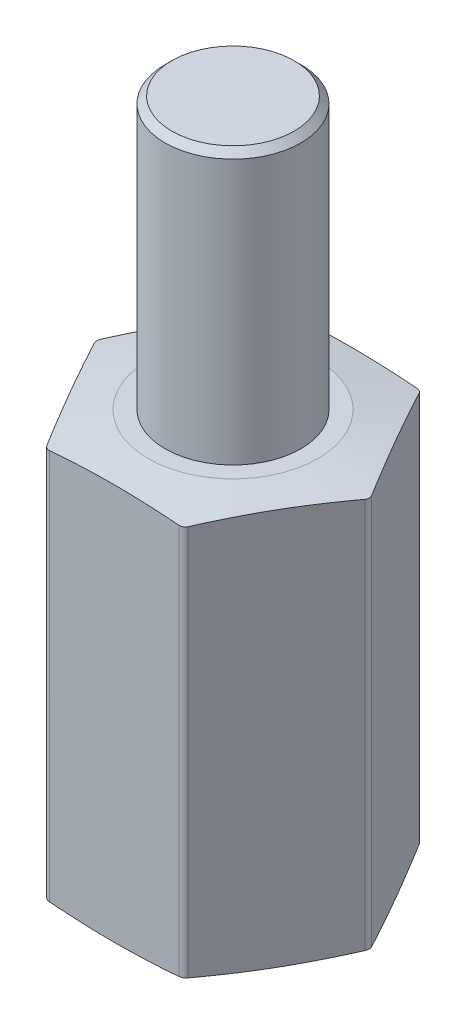
from build123d import *

# Parameters (mm, degrees)
EXTRUDE_1_DEPTH     = 6
FILLET_1_R          = 0.2
SKETCH_3_R          = 2
CUT_EXTRUDE_1_DEPTH = 8
SKETCH_5_R          = 2
EXTRUDE_2_DEPTH     = 8
CHAMFER_1_SIZE      = 0.2


with BuildPart() as part:
    # 草图1 → 凸台-拉伸1 (new, symmetric)
    with BuildSketch(Plane(origin=(0, 0, 0), x_dir=(1, 0, 0), z_dir=(0, 1, 0))):
        Polygon((4.041451884, 0), (2.020725942, 3.5), (-2.020725942, 3.5), (-4.041451884, 0), (-2.020725942, -3.5), (2.020725942, -3.5), align=None)
    extrude(amount=EXTRUDE_1_DEPTH, both=True)

    # 圆角1
    fillet_1_edges = [part.edges().sort_by_distance(p)[0] for p in [
        (2.020725942, 0, 3.5),
        (-2.020725942, 0, 3.5),
        (-4.041451884, 0, 0),
        (-2.020725942, 0, -3.5),
        (2.020725942, 0, -3.5),
        (4.041451884, 0, 0),
    ]]
    fillet(fillet_1_edges, radius=FILLET_1_R)

    # 草图3 → 切除-拉伸1 (cut)
    with BuildSketch(Plane(origin=(0, -6, 0), x_dir=(1, 0, 0), z_dir=(0, 1, 0))):
        with Locations(Location((0, 0, 0), (0, 0, 270))):
            Circle(SKETCH_3_R)
    extrude(amount=CUT_EXTRUDE_1_DEPTH, mode=Mode.SUBTRACT)

    # 草图4 → 切除-旋转1 (revolve, cut)
    with BuildSketch(Plane.XY, mode=Mode.PRIVATE) as cut_revolve_1_sk:
        Polygon((-4.010511777, 6), (-4.010511777, 5.75), (-2.5, 6), align=None)
    cut_revolve_1 = revolve(cut_revolve_1_sk.sketch.rotate(Axis((0, 0, 0), (0, 1, 0)), 180), axis=Axis((0, 0, 0), (0, 1, 0)), mode=Mode.SUBTRACT)

    # 镜向1: 切除-旋转1 across plane
    add(cut_revolve_1.mirror(Plane.ZX), mode=Mode.SUBTRACT)

    # 草图5 → 凸台-拉伸2 (add)
    with BuildSketch(Plane(origin=(0, 6, 0), x_dir=(1, 0, 0), z_dir=(0, 1, 0))):
        with Locations(Location((0, 0, 0), (0, 0, 270))):
            Circle(SKETCH_5_R)
    extrude(amount=EXTRUDE_2_DEPTH)

    # 倒角1
    chamfer_1_edges = [part.edges().sort_by_distance(p)[0] for p in [
        (0, 14, -2),
    ]]
    chamfer(chamfer_1_edges, length=CHAMFER_1_SIZE)


solid = part.part
